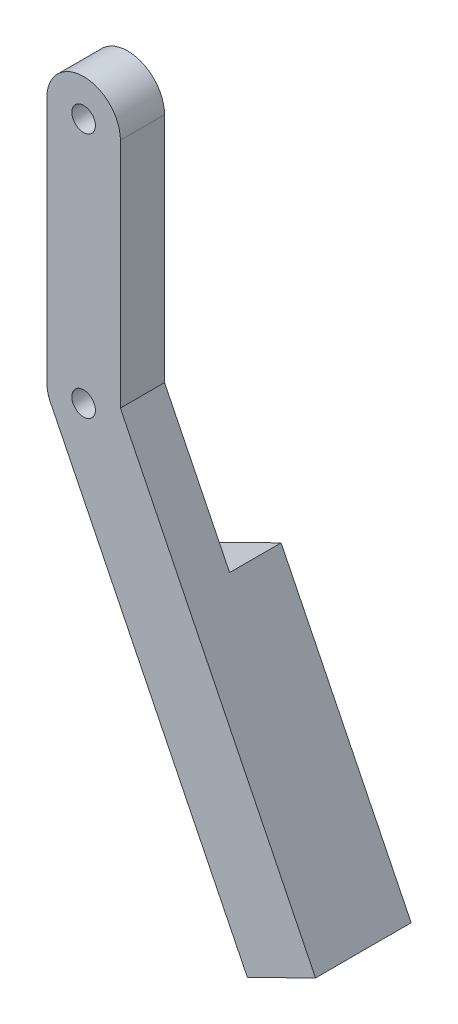
from build123d import *

# Parameters (mm, degrees)
SALIENTE_EXTRUIR1_DEPTH = 6
CROQUIS2_R              = 1.6
CORTAR_EXTRUIR1_DEPTH   = 65.918146911
SALIENTE_EXTRUIR2_DEPTH = 7


with BuildPart() as part:
    # Croquis1 → Saliente-Extruir1 (new body)
    with BuildSketch(Plane.XY):
        with BuildLine():
            Line((-5, 33.48), (-5, 0))
            ThreePointArc((-5, 0), (0, -5), (5, 0))
            Line((5, 0), (5, 33.48))
            ThreePointArc((5, 33.48), (0, 38.48), (-5, 33.48))
        make_face()
        with BuildLine():
            ThreePointArc((5, 0), (1.357892891, -4.812081348), (-4.262450759, -2.613716421))
            Line((-4.262450759, -2.613716421), (22.256084979, -56.435340907))
            Line((22.256084979, -56.435340907), (31.518535738, -51.871624486))
            Line((31.518535738, -51.871624486), (5, 1.95))
            Line((5, 1.95), (5, 0))
        make_face()
    extrude(amount=SALIENTE_EXTRUIR1_DEPTH)

    # Croquis2 → Cortar-Extruir1 (cut, through all)
    with BuildSketch(Plane.XY.offset(6)):
        with Locations((0, 33.48)):
            Circle(CROQUIS2_R)
        Circle(CROQUIS2_R)
    extrude(amount=-CORTAR_EXTRUIR1_DEPTH, mode=Mode.SUBTRACT)

    # Croquis3 → Saliente-Extruir2 (add)
    with BuildSketch(Plane(origin=(0, 0, 0), x_dir=(-1, 0, 0), z_dir=(0, 0, -1))):
        Polygon((-31.518535738, -51.871624486), (-22.256084979, -56.435340907), (-4.577061154, -20.554257916), (-13.839511913, -15.990541495), align=None)
    extrude(amount=SALIENTE_EXTRUIR2_DEPTH)


solid = part.part
